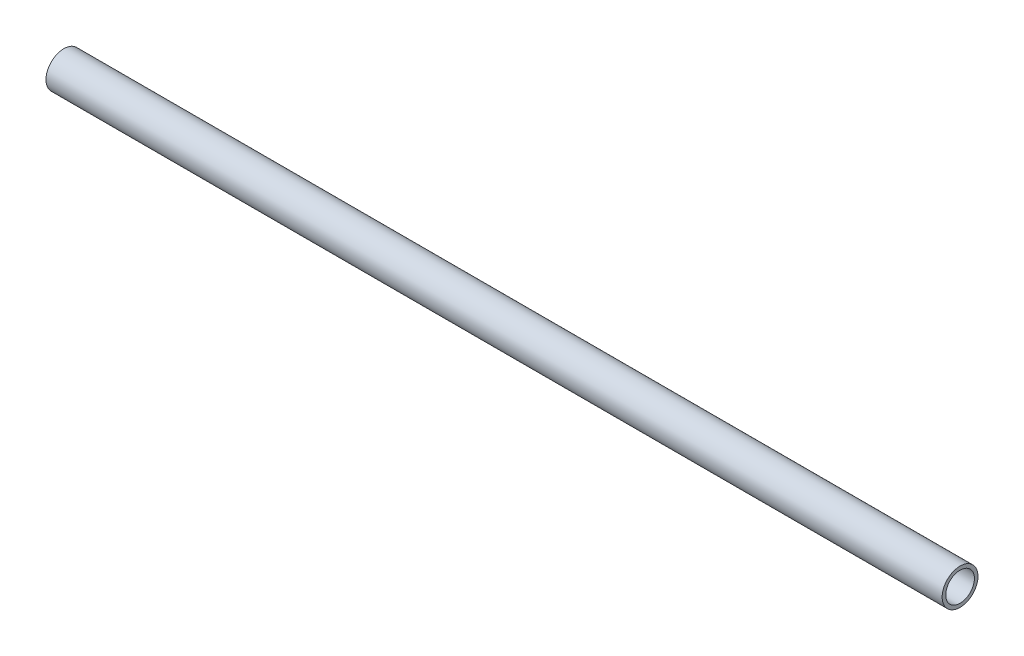
from build123d import *

# Parameters (mm, degrees)
SKETCH1_R           = 5
SKETCH1_R_2         = 4
BOSS_EXTRUDE1_DEPTH = 250


with BuildPart() as part:
    # Sketch1 → Boss-Extrude1 (new body)
    with BuildSketch(Plane(origin=(0, 0, 0), x_dir=(0, 0, -1), z_dir=(1, 0, 0))):
        Circle(SKETCH1_R)
        Circle(SKETCH1_R_2, mode=Mode.SUBTRACT)
    extrude(amount=BOSS_EXTRUDE1_DEPTH)


solid = part.part
